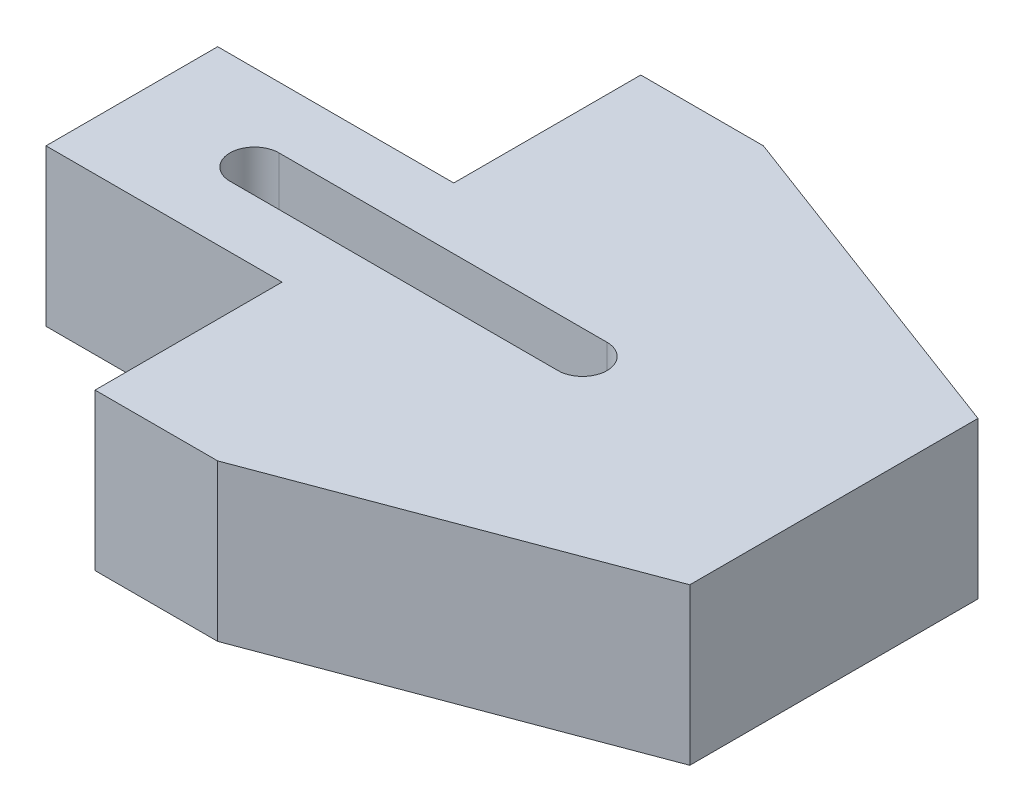
from build123d import *

# Parameters (mm, degrees)
BOSS_EXTRUDE1_DEPTH = 2.55
CUT_EXTRUDE1_DEPTH  = 26.092429137


with BuildPart() as part:
    # Sketch1 → Boss-Extrude1 (new, symmetric)
    with BuildSketch(Plane(origin=(0, 0, 0), x_dir=(1, 0, 0), z_dir=(0, 1, 0))):
        Polygon((-22.9, 0), (-22.9, 2.8), (-15.2, 2.8), (-15.2, 8.9), (-11.2, 8.9), (0, 4.7), (0, 0), align=None)
    boss_extrude1 = extrude(amount=BOSS_EXTRUDE1_DEPTH, both=True)

    # Mirror1: Boss-Extrude1 across plane
    add(boss_extrude1.mirror(Plane.XY))

    # Sketch2 → Cut-Extrude1 (cut, through all)
    with BuildSketch(Plane(origin=(0, 2.55, 0), x_dir=(1, 0, 0), z_dir=(0, 1, 0))):
        with BuildLine():
            Line((-18.9, 0.8), (-8.2, 0.8))
            ThreePointArc((-8.2, 0.8), (-7.4, 0), (-8.2, -0.8))
            Line((-8.2, -0.8), (-18.9, -0.8))
            ThreePointArc((-18.9, -0.8), (-19.7, 0), (-18.9, 0.8))
        make_face()
    extrude(amount=-CUT_EXTRUDE1_DEPTH, mode=Mode.SUBTRACT)


solid = part.part
